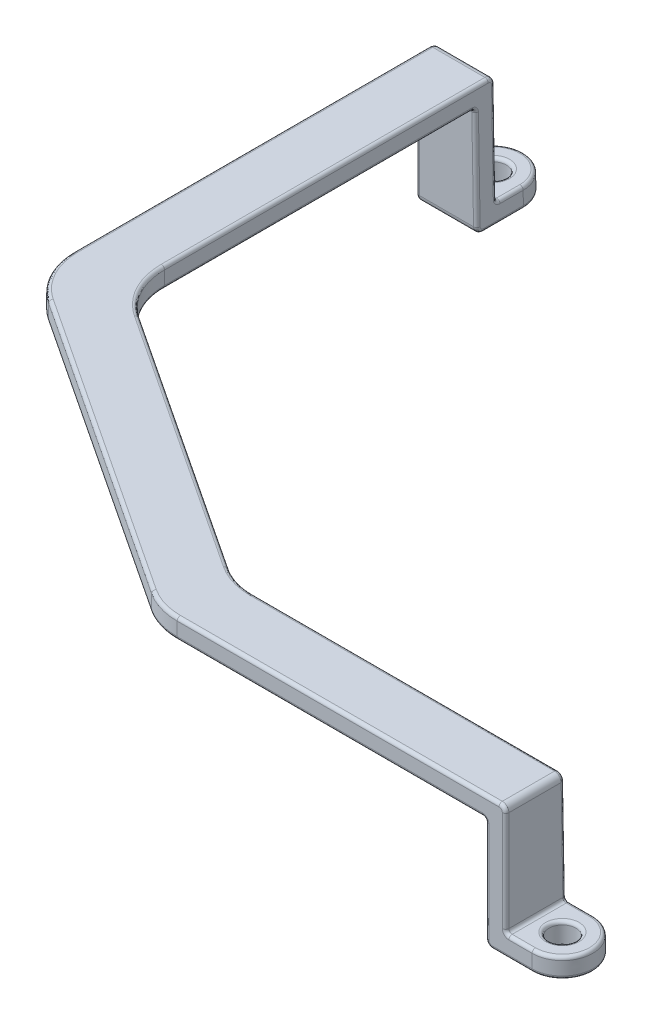
from build123d import *

# Parameters (mm, degrees)
SKETCH1_R           = 1
BOSS_EXTRUDE1_DEPTH = 9.75
BOSS_EXTRUDE1_DRAFT = 0.5
CUT_EXTRUDE1_DEPTH  = 55.75
CUT_EXTRUDE2_DEPTH  = 27.875
FILLET1_R           = 5
FILLET2_R           = 0.5
FILLET3_R           = 0.25
FILLET4_R           = 0.5
FILLET5_R           = 0.25
FILLET6_R           = 0.25
FILLET7_R           = 0.25


with BuildPart() as part:
    # Sketch1 → Boss-Extrude1 (with draft: the straight prism first)
    with BuildSketch(Plane(origin=(0, 0, 0), x_dir=(1, 0, 0), z_dir=(0, 1, 0))):
        with BuildLine():
            Line((-9.6, 6.335294118), (-9.6, 35.975))
            ThreePointArc((-9.6, 35.975), (-11.9, 38.275), (-14.2, 35.975))
            Line((-14.2, 35.975), (-14.2, 3.859581975))
            Line((-14.2, 3.859581975), (12.218976586, -13.575))
            Line((12.218976586, -13.575), (40.6, -13.575))
            ThreePointArc((40.6, -13.575), (42.9, -11.275), (40.6, -8.975))
            Line((40.6, -8.975), (13.6, -8.975))
            Line((13.6, -8.975), (-9.6, 6.335294118))
        make_face()
        with Locations((-11.9, 35.975)):
            Circle(SKETCH1_R, mode=Mode.SUBTRACT)
        with Locations((40.6, -11.275)):
            Circle(SKETCH1_R, mode=Mode.SUBTRACT)
    extrude(amount=BOSS_EXTRUDE1_DEPTH)
    # Boss-Extrude1: the draft: its side faces are tilted about the plane it starts from
    boss_extrude1_sides = [part.faces().sort_by_distance(p)[0] for p in [
        (27.1, 4.875, 8.975),
        (2, 4.875, 1.319852941),
        (-9.6, 4.875, -21.155147059),
        (-11.9, 4.875, -38.275),
        (-14.2, 4.875, -19.917290987),
        (-0.990511707, 4.875, 4.857709013),
        (26.409488293, 4.875, 13.575),
        (42.9, 4.875, 11.275),
        (-12.9, 4.875, -35.975),
        (39.6, 4.875, 11.275),
    ]]
    draft(boss_extrude1_sides, Plane(origin=(0, 0, 0), x_dir=(1, 0, 0), z_dir=(0, 1, 0)), BOSS_EXTRUDE1_DRAFT)

    # Sketch3 → Cut-Extrude1 (cut)
    with BuildSketch(Plane(origin=(0, 0, 0), x_dir=(0, 0, -1), z_dir=(1, 0, 0))):
        Polygon((41.59614752, 1.5), (33.975, 1.5), (33.89145137, 11.073724745), (41.59614752, 11.073724745), align=None)
        Polygon((32.475, 0), (32.403003341, 8.25), (27.406352465, 8.25), (-15.584241213, 8.25), (-15.584241213, -1.476322626), (32.475, -1.476322626), align=None)
    extrude(amount=-CUT_EXTRUDE1_DEPTH, mode=Mode.SUBTRACT)

    # Sketch4 → Cut-Extrude2 (cut, symmetric)
    with BuildSketch(Plane.XY):
        Polygon((38.6, 1.5), (38.508303197, 12.007412904), (43.724558545, 10.836267352), (43.724558545, 1.5), align=None)
        Polygon((37.1, 0), (37.028003341, 8.25), (-4.50235506, 8.25), (-4.50235506, -4.924032626), (37.1, -4.924032626), align=None)
    extrude(amount=CUT_EXTRUDE2_DEPTH, both=True, mode=Mode.SUBTRACT)

    # Fillet1
    fillet1_edges = [part.edges().sort_by_distance(p)[0] for p in [
        (-9.67854181, 9, -6.29302305),
        (13.576419983, 9, 9.05354181),
        (12.242556603, 9, 13.49645819),
        (-14.12145819, 9, -3.901853043),
    ]]
    fillet(fillet1_edges, radius=FILLET1_R)

    # Fillet2
    fillet2_edges = [part.edges().sort_by_distance(p)[0] for p in [
        (-11.9, 9.75, -33.903003341),
        (38.528003341, 9.75, 11.275),
    ]]
    fillet(fillet2_edges, radius=FILLET2_R)

    # Fillet3
    fillet3_edges = [part.edges().sort_by_distance(p)[0] for p in [
        (37.028003341, 8.25, 11.275),
        (-11.9, 8.25, -32.403003341),
    ]]
    fillet(fillet3_edges, radius=FILLET3_R)

    # Fillet4
    fillet4_edges = [part.edges().sort_by_distance(p)[0] for p in [
        (37.1, 0, 11.275),
        (-11.9, 0, -32.475),
    ]]
    fillet(fillet4_edges, radius=FILLET4_R)

    # Fillet5
    fillet5_edges = [part.edges().sort_by_distance(p)[0] for p in [
        (-11.9, 1.5, -33.975),
        (38.6, 1.5, 11.275),
    ]]
    fillet(fillet5_edges, radius=FILLET5_R)

    # Fillet6
    fillet6_edges = [part.edges().sort_by_distance(p)[0] for p in [
        (-14.2, 0, -34.472827803),
        (-11.9, 0, -38.275),
        (2.449734165, 8.25, 1.702905402),
        (2.441224013, 9.75, 1.712973142),
        (25.888962294, 9.75, 13.489913039),
        (25.260911194, 8.25, 13.503003341),
        (-9.671996659, 8.25, -20.571305086),
        (-0.447165867, 8.25, 5.130016335),
        (-13.530868387, 8.25, -4.219707466),
        (12.303984634, 8.25, 13.291849825),
        (-0.438655715, 9.75, 5.119948595),
        (-9.685086961, 9.75, -21.193868596),
        (-13.517778085, 9.75, -4.226752644),
        (12.307914637, 9.75, 13.278759523),
        (13.641778017, 8.25, 8.835843144),
        (13.637848014, 9.75, 8.848933445),
        (-9.074861705, 8.25, -6.617922651),
        (-9.087952007, 9.75, -6.610877473),
        (-14.151992708, 5.501090817, -33.940083009),
        (-9.683822345, 9.605089366, -33.759358448),
        (26.553928983, 9.75, 9.060086961),
        (-14.114913039, 9.75, -20.001806181),
        (-14.116177655, 9.605089366, -33.759358448),
        (38.565083009, 5.501090817, 9.023007292),
        (38.384358448, 9.605089366, 13.491177655),
        (38.384358448, 9.605089366, 9.058822345),
        (-14.128003341, 8.25, -19.372197493),
        (25.929807886, 8.25, 9.046996659),
        (-9.637079669, 4.248909183, -32.437920331),
        (37.062920331, 4.248909183, 13.537920331),
        (-9.671364351, 8.177544683, -32.331180895),
        (-14.128635649, 8.177544683, -32.331180895),
        (36.956180895, 8.177544683, 13.503635649),
        (36.956180895, 8.177544683, 9.046364351),
        (37.062920331, 4.248909183, 9.012079669),
        (39.097827803, 0, 13.575),
        (37.243644892, 0.144910634, 13.573735384),
        (37.243644892, 0.144910634, 8.976264616),
        (-14.162920331, 4.248909183, -32.437920331),
        (-9.6, 0, -34.472827803),
        (-9.601264616, 0.144910634, -32.618644892),
        (-14.198735384, 0.144910634, -32.618644892),
        (-14.186909698, 1.5, -35.098913901),
        (-9.648007292, 5.501090817, -33.940083009),
        (39.723913901, 1.5, 8.988090302),
        (38.565083009, 5.501090817, 13.526992708),
        (-9.61372261, 1.572455317, -34.046822446),
        (-14.18627739, 1.572455317, -34.046822446),
        (38.671822446, 1.572455317, 13.56127739),
        (38.671822446, 1.572455317, 8.98872261),
        (-11.9, 1.5, -38.261909698),
        (-9.613090302, 1.5, -35.098913901),
        (42.886909698, 1.5, 11.275),
        (39.723913901, 1.5, 13.561909698),
        (39.097827803, 0, 8.975),
        (42.9, 0, 11.275),
    ]]
    fillet(fillet6_edges, radius=FILLET6_R)

    # Fillet7
    fillet7_edges = [part.edges().sort_by_distance(p)[0] for p in [
        (-12.913090302, 1.5, -35.975),
        (39.586909698, 1.5, 11.275),
    ]]
    fillet(fillet7_edges, radius=FILLET7_R)


solid = part.part
